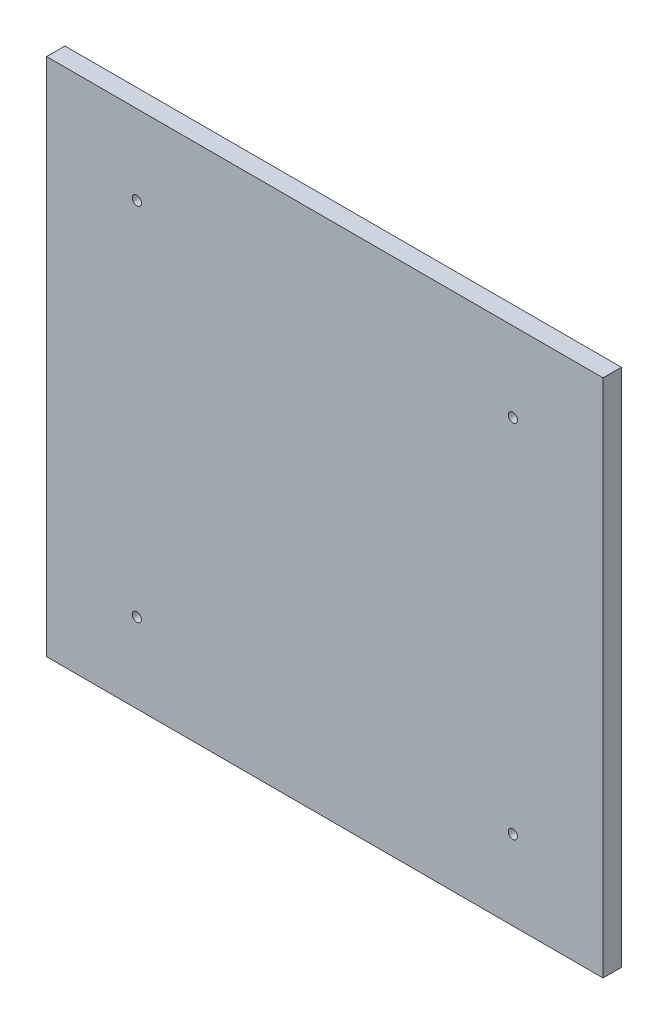
from build123d import *

# Parameters (mm, degrees)
ESBO_O1_W                = 182
ESBO_O1_H                = 170
ESBO_O1_R                = 1.5
RESSALTO_EXTRUS_O1_DEPTH = 6


with BuildPart() as part:
    # Esboço1 → Ressalto-extrusão1 (new body)
    with BuildSketch(Plane.XY):
        Rectangle(ESBO_O1_W, ESBO_O1_H)
        with Locations((-61.5, 59)):
            Circle(ESBO_O1_R, mode=Mode.SUBTRACT)
        with Locations((61.5, 59)):
            Circle(ESBO_O1_R, mode=Mode.SUBTRACT)
        with Locations(Location((61.5, -59, 0), (0, 0, 180))):
            Circle(ESBO_O1_R, mode=Mode.SUBTRACT)
        with Locations(Location((-61.5, -59, 0), (0, 0, 180))):
            Circle(ESBO_O1_R, mode=Mode.SUBTRACT)
    extrude(amount=RESSALTO_EXTRUS_O1_DEPTH)


solid = part.part
